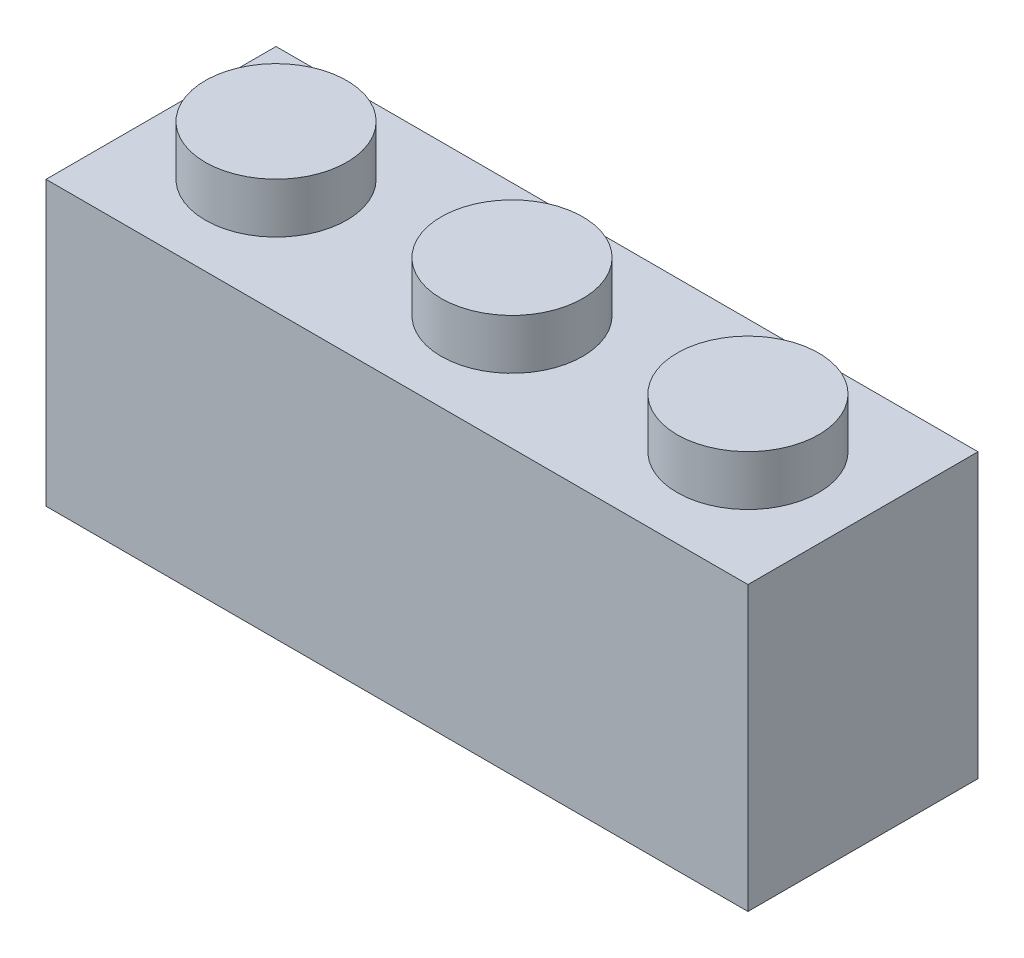
from build123d import *

# Parameters (mm, degrees)
SKETCH_1_W          = 23.8
SKETCH_1_H          = 7.8
EXTRUDE_1_DEPTH     = 9.6
SKETCH_2_R          = 2.4
EXTRUDE_2_DEPTH     = 1.7
SKETCH_3_R          = 2.5
CUT_EXTRUDE_1_DEPTH = 1.8


with BuildPart() as part:
    # Эскиз1 → Бобышка-Вытянуть1 (new body)
    with BuildSketch(Plane(origin=(0, 0, 0), x_dir=(1, 0, 0), z_dir=(0, 1, 0))):
        Rectangle(SKETCH_1_W, SKETCH_1_H)
    extrude(amount=EXTRUDE_1_DEPTH)

    # Эскиз2 → Бобышка-Вытянуть2 (add)
    with BuildSketch(Plane(origin=(0, 9.6, 0), x_dir=(1, 0, 0), z_dir=(0, 1, 0))):
        with Locations(Location((-8, 0, 0), (0, 0, 270))):
            Circle(SKETCH_2_R)
        with Locations(Location((0, 0, 0), (0, 0, 270))):
            Circle(SKETCH_2_R)
        with Locations(Location((8, 0, 0), (0, 0, 270))):
            Circle(SKETCH_2_R)
    extrude(amount=EXTRUDE_2_DEPTH)

    # Эскиз3 → Вырез-Вытянуть1 (cut)
    with BuildSketch(Plane.XZ):
        with Locations(Location((-8, 0, 0), (0, 0, 270))):
            Circle(SKETCH_3_R)
        with Locations(Location((0, 0, 0), (0, 0, 270))):
            Circle(SKETCH_3_R)
        with Locations(Location((8, 0, 0), (0, 0, 270))):
            Circle(SKETCH_3_R)
    extrude(amount=-CUT_EXTRUDE_1_DEPTH, mode=Mode.SUBTRACT)


solid = part.part
